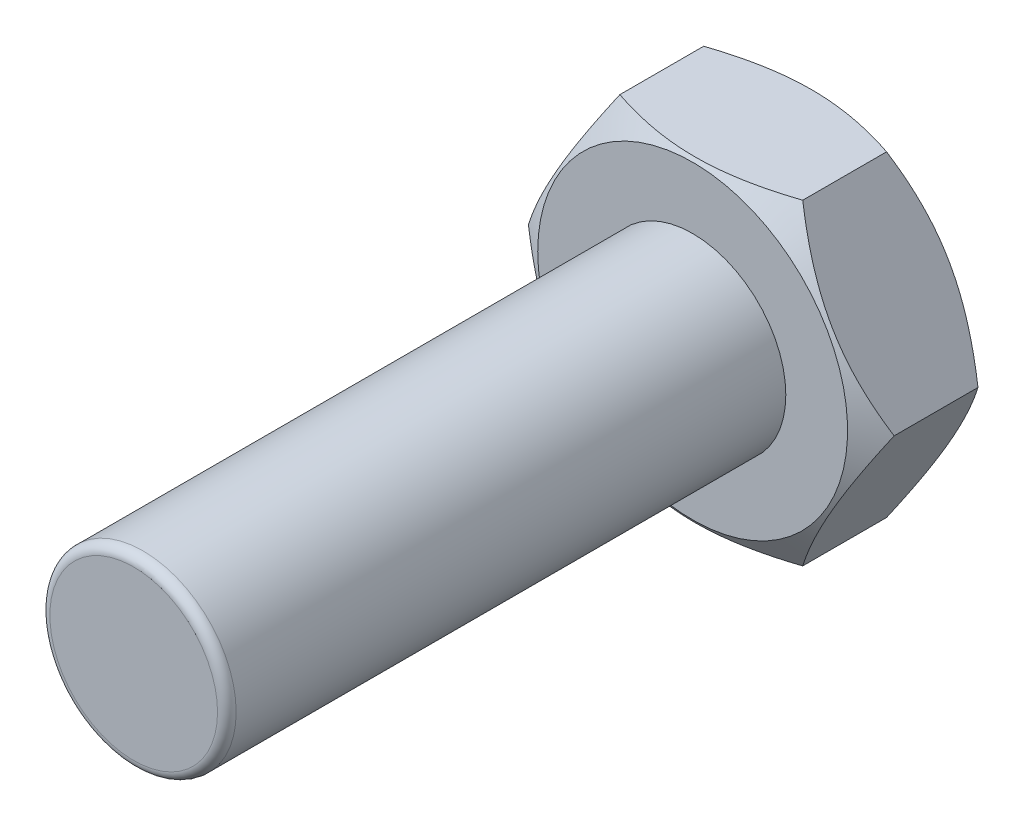
from build123d import *

# Parameters (mm, degrees)
Y_KSEKLIK_EKSTR_ZYON1_DEPTH = 6.5
IZIM2_R                     = 5
Y_KSEKLIK_EKSTR_ZYON2_DEPTH = 30
RADYUS1_R                   = 0.5


with BuildPart() as part:
    # Çizim1 → Yükseklik-Ekstrüzyon1 (new body)
    with BuildSketch(Plane.XY):
        Polygon((9.814954576, 0), (4.907477288, 8.5), (-4.907477288, 8.5), (-9.814954576, 0), (-4.907477288, -8.5), (4.907477288, -8.5), align=None)
    extrude(amount=Y_KSEKLIK_EKSTR_ZYON1_DEPTH)

    # Çizim2 → Yükseklik-Ekstrüzyon2 (add)
    with BuildSketch(Plane.XY.offset(6.5)):
        Circle(IZIM2_R)
    extrude(amount=Y_KSEKLIK_EKSTR_ZYON2_DEPTH)

    # Çizim3 → Kes-Döndür1 (revolve, cut)
    with BuildSketch(Plane(origin=(0, 0, 0), x_dir=(1, 0, 0), z_dir=(0, 1, 0))):
        Polygon((-9.814954576, 0), (-8.314954576, 0), (-9.814954576, -1), align=None)
        Polygon((-9.814954576, -6.5), (-9.814954576, -5.5), (-8.314954576, -6.5), align=None)
    revolve(axis=Axis((0, 0, 0), (0, 0, 1)), mode=Mode.SUBTRACT)

    # Radyus1
    radyus1_edges = [part.edges().sort_by_distance(p)[0] for p in [
        (-5, 0, 36.5),
    ]]
    fillet(radyus1_edges, radius=RADYUS1_R)


solid = part.part
